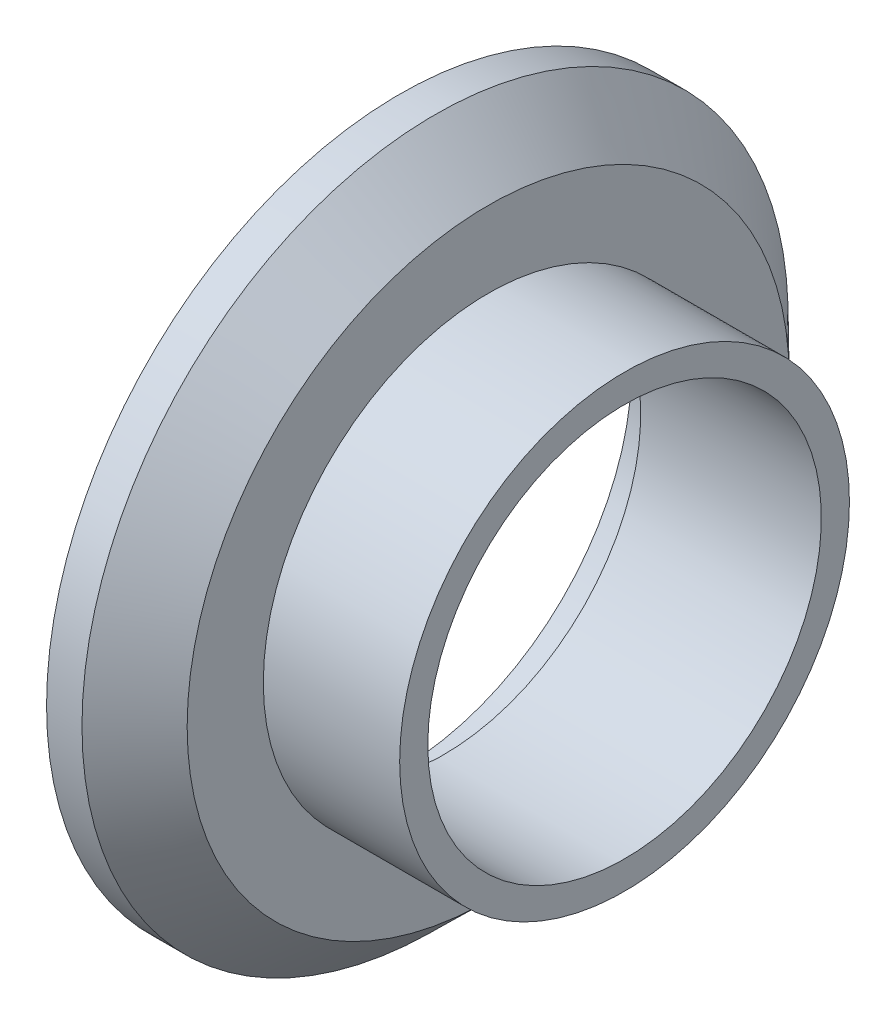
from build123d import *


with BuildPart() as part:
    # Axial profile (mm) → Full revolution (revolve)
    with BuildSketch(Plane.XY, mode=Mode.PRIVATE) as full_revolution_sk:
        Polygon((3.5, 11.1125), (13.7, 11.1125), (13.7, 12.7), (6, 12.7), (6, 17), (3, 19.94), (1, 19.94), (1, 13.1), (3.5, 13.1), align=None)
    revolve(full_revolution_sk.sketch.rotate(Axis((-110, 0, 0), (1, 0, 0)), 90), axis=Axis((-110, 0, 0), (1, 0, 0)))


solid = part.part
